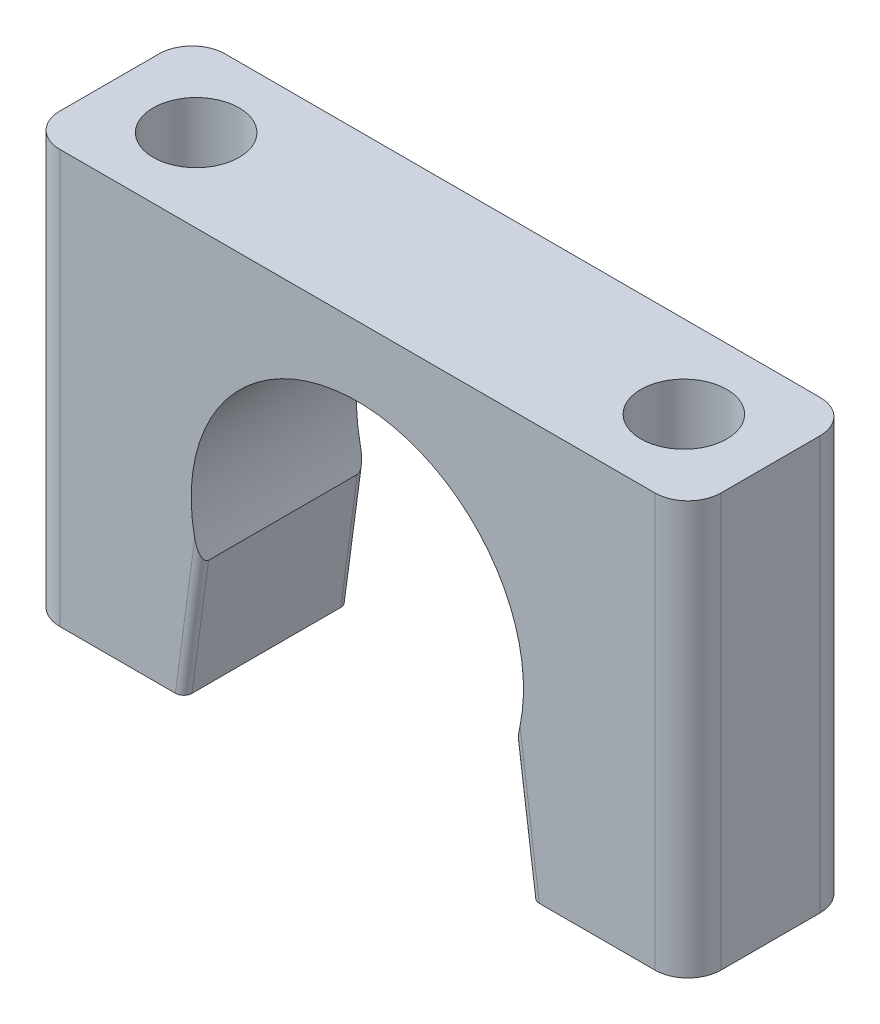
from build123d import *

# Parameters (mm, degrees)
BOSS_EXTRUDE2_DEPTH = 10
SKETCH3_R           = 2.6
CUT_EXTRUDE1_DEPTH  = 34.541019662
FILLET1_R           = 2
CUT_EXTRUDE2_DEPTH  = 27.515325757
FILLET2_R           = 0.5


with BuildPart() as part:
    # Sketch2 → Boss-Extrude2 (new body)
    with BuildSketch(Plane.XY):
        with BuildLine():
            Line((9.5, -10.75), (9.5, -3.279100486))
            ThreePointArc((9.5, -3.279100486), (0, 10.05), (-9.5, -3.279100486))
            Line((-9.5, -3.279100486), (-9.5, -10.75))
            Line((-9.5, -10.75), (-20, -10.75))
            Line((-20, -10.75), (-20, 14.25))
            Line((-20, 14.25), (20, 14.25))
            Line((20, 14.25), (20, -10.75))
            Line((20, -10.75), (9.5, -10.75))
        make_face()
    extrude(amount=BOSS_EXTRUDE2_DEPTH)

    # Sketch3 → Cut-Extrude1 (cut, through all)
    with BuildSketch(Plane.XZ.offset(10.75)):
        with Locations((-14.75, 5)):
            Circle(SKETCH3_R)
        with Locations((14.75, 5)):
            Circle(SKETCH3_R)
    extrude(amount=-CUT_EXTRUDE1_DEPTH, mode=Mode.SUBTRACT)

    # Fillet1
    fillet1_edges = [part.edges().sort_by_distance(p)[0] for p in [
        (20, 1.75, 10),
        (-20, 1.75, 10),
        (-20, 1.75, 0),
        (20, 1.75, 0),
    ]]
    fillet(fillet1_edges, radius=FILLET1_R)

    # Sketch4 → Cut-Extrude2 (cut, through all)
    with BuildSketch(Plane.XY.offset(10)):
        Polygon((-9.5, -10.75), (-9.5, -3.279100486), (-10.5, -10.75), align=None)
        Polygon((9.5, -10.75), (9.5, -3.279100486), (10.5, -10.75), align=None)
    extrude(amount=-CUT_EXTRUDE2_DEPTH, mode=Mode.SUBTRACT)

    # Fillet2
    fillet2_edges = [part.edges().sort_by_distance(p)[0] for p in [
        (-10, -7.014550243, 0),
        (-10, -7.014550243, 10),
        (10, -7.014550243, 0),
        (10, -7.014550243, 10),
    ]]
    fillet(fillet2_edges, radius=FILLET2_R)


solid = part.part
